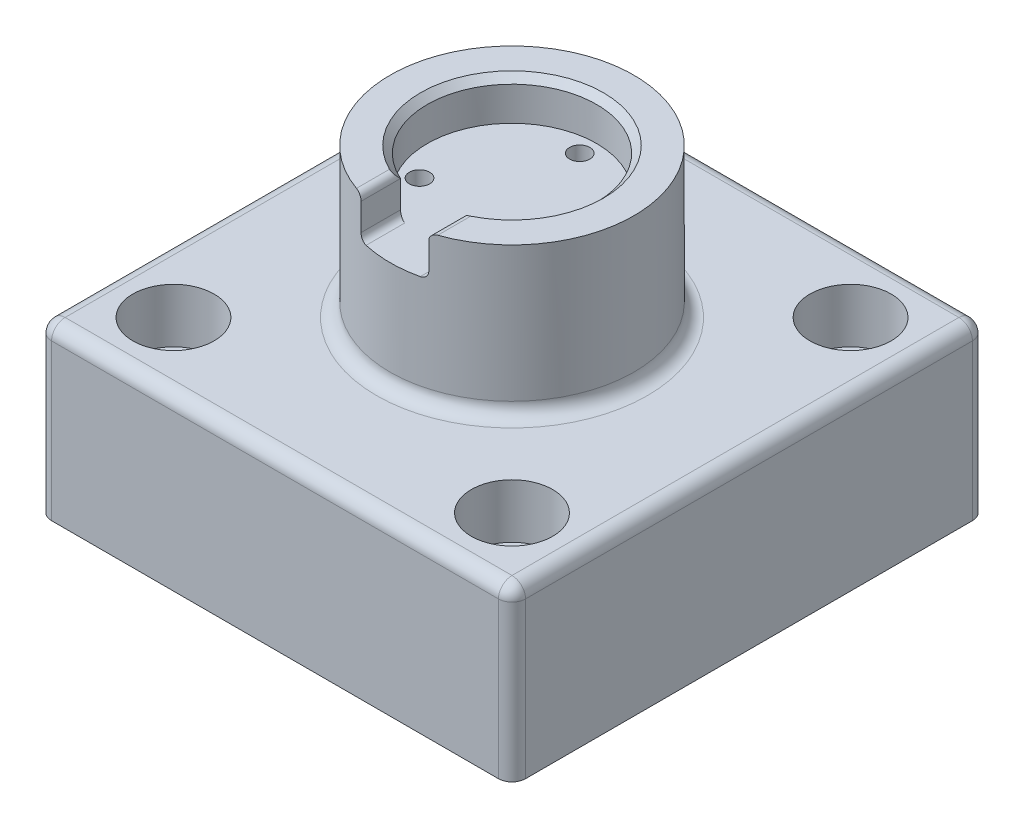
from build123d import *

# Parameters (mm, degrees)
SKETCH_1_W          = 70
SKETCH_1_H          = 70
EXTRUDE_1_DEPTH     = 25
SKETCH_2_R          = 18
EXTRUDE_2_DEPTH     = 22
SKETCH_3_R          = 12.5
CUT_EXTRUDE_1_DEPTH = 6
SKETCH_5_R          = 1.5
CUT_EXTRUDE_2_DEPTH = 65.272855857
SKETCH_6_W          = 10
SKETCH_6_H          = 12
CUT_EXTRUDE_3_DEPTH = 20
SKETCH_7_R          = 3
CUT_EXTRUDE_4_DEPTH = 69.256867786
SKETCH_8_R          = 6
CUT_EXTRUDE_5_DEPTH = 8
SKETCH_9_W          = 36
SKETCH_9_H          = 36
CUT_EXTRUDE_6_DEPTH = 12
FILLET_1_R          = 2
FILLET_2_R          = 2
CHAMFER_1_SIZE      = 1
FILLET_3_R          = 1


with BuildPart() as part:
    # 草图1 → 凸台-拉伸1 (new body)
    with BuildSketch(Plane(origin=(0, 0, 0), x_dir=(1, 0, 0), z_dir=(0, 1, 0))):
        Rectangle(SKETCH_1_W, SKETCH_1_H)
    extrude(amount=EXTRUDE_1_DEPTH)

    # 草图2 → 凸台-拉伸2 (add)
    with BuildSketch(Plane(origin=(0, 25, 0), x_dir=(1, 0, 0), z_dir=(0, 1, 0))):
        with Locations(Location((0, 0, 0), (0, 0, 270))):
            Circle(SKETCH_2_R)
    extrude(amount=EXTRUDE_2_DEPTH)

    # 草图3 → 切除-拉伸1 (cut)
    with BuildSketch(Plane(origin=(0, 47, 0), x_dir=(1, 0, 0), z_dir=(0, 1, 0))):
        with Locations(Location((0, 0, 0), (0, 0, 270))):
            Circle(SKETCH_3_R)
    extrude(amount=-CUT_EXTRUDE_1_DEPTH, mode=Mode.SUBTRACT)

    # 草图5 → 切除-拉伸2 (cut, through all)
    with BuildSketch(Plane(origin=(0, 41, 0), x_dir=(1, 0, 0), z_dir=(0, 1, 0))):
        with Locations(Location((0, 10, 0), (0, 0, 270))):
            Circle(SKETCH_5_R)
        with Locations(Location((8.660254038, -5, 0), (0, 0, 270))):
            Circle(SKETCH_5_R)
        with Locations(Location((-8.660254038, -5, 0), (0, 0, 270))):
            Circle(SKETCH_5_R)
    extrude(amount=-CUT_EXTRUDE_2_DEPTH, mode=Mode.SUBTRACT)

    # 草图6 → 切除-拉伸3 (cut)
    with BuildSketch(Plane.XY):
        with Locations((0, 47)):
            Rectangle(SKETCH_6_W, SKETCH_6_H)
    extrude(amount=CUT_EXTRUDE_3_DEPTH, mode=Mode.SUBTRACT)

    # 草图7 → 切除-拉伸4 (cut, through all)
    with BuildSketch(Plane(origin=(0, 0, 0), x_dir=(1, 0, 0), z_dir=(0, 1, 0))):
        with Locations(Location((-25, 25, 0), (0, 0, 270))):
            Circle(SKETCH_7_R)
        with Locations(Location((25, 25, 0), (0, 0, 270))):
            Circle(SKETCH_7_R)
        with Locations(Location((25, -25, 0), (0, 0, 270))):
            Circle(SKETCH_7_R)
        with Locations(Location((-25, -25, 0), (0, 0, 270))):
            Circle(SKETCH_7_R)
    extrude(amount=CUT_EXTRUDE_4_DEPTH, mode=Mode.SUBTRACT)

    # 草图8 → 切除-拉伸5 (cut)
    with BuildSketch(Plane(origin=(0, 25, 0), x_dir=(1, 0, 0), z_dir=(0, 1, 0))):
        with Locations(Location((-25, 25, 0), (0, 0, 270))):
            Circle(SKETCH_8_R)
        with Locations(Location((25, 25, 0), (0, 0, 90))):
            Circle(SKETCH_8_R)
        with Locations(Location((25, -25, 0), (0, 0, 270))):
            Circle(SKETCH_8_R)
        with Locations(Location((-25, -25, 0), (0, 0, 90))):
            Circle(SKETCH_8_R)
    extrude(amount=-CUT_EXTRUDE_5_DEPTH, mode=Mode.SUBTRACT)

    # 草图9 → 切除-拉伸6 (cut)
    with BuildSketch(Plane.XZ):
        Rectangle(SKETCH_9_W, SKETCH_9_H)
    extrude(amount=-CUT_EXTRUDE_6_DEPTH, mode=Mode.SUBTRACT)

    # 圆角1
    fillet_1_edges = [part.edges().sort_by_distance(p)[0] for p in [
        (0, 25, 35),
        (18, 12, 0),
        (18, 6, 18),
        (0, 12, -18),
        (18, 6, -18),
        (-18, 12, 0),
        (-18, 6, -18),
        (0, 12, 18),
        (35, 25, 0),
        (-35, 12.5, -35),
        (35, 12.5, -35),
        (35, 12.5, 35),
        (-35, 12.5, 35),
        (0, 25, -35),
        (-35, 25, 0),
    ]]
    fillet(fillet_1_edges, radius=FILLET_1_R)

    # 圆角2
    fillet_2_edges = [part.edges().sort_by_distance(p)[0] for p in [
        (0, 25, -18),
    ]]
    fillet(fillet_2_edges, radius=FILLET_2_R)

    # 倒角1
    chamfer_1_edges = [part.edges().sort_by_distance(p)[0] for p in [
        (0, 47, -12.5),
    ]]
    chamfer(chamfer_1_edges, length=CHAMFER_1_SIZE)

    # 圆角3
    fillet_3_edges = [part.edges().sort_by_distance(p)[0] for p in [
        (-5, 47, 14.915776335),
        (5, 47, 14.915776335),
        (5, 41, 14.374027852),
        (-5, 41, 14.374027852),
    ]]
    fillet(fillet_3_edges, radius=FILLET_3_R)


solid = part.part
